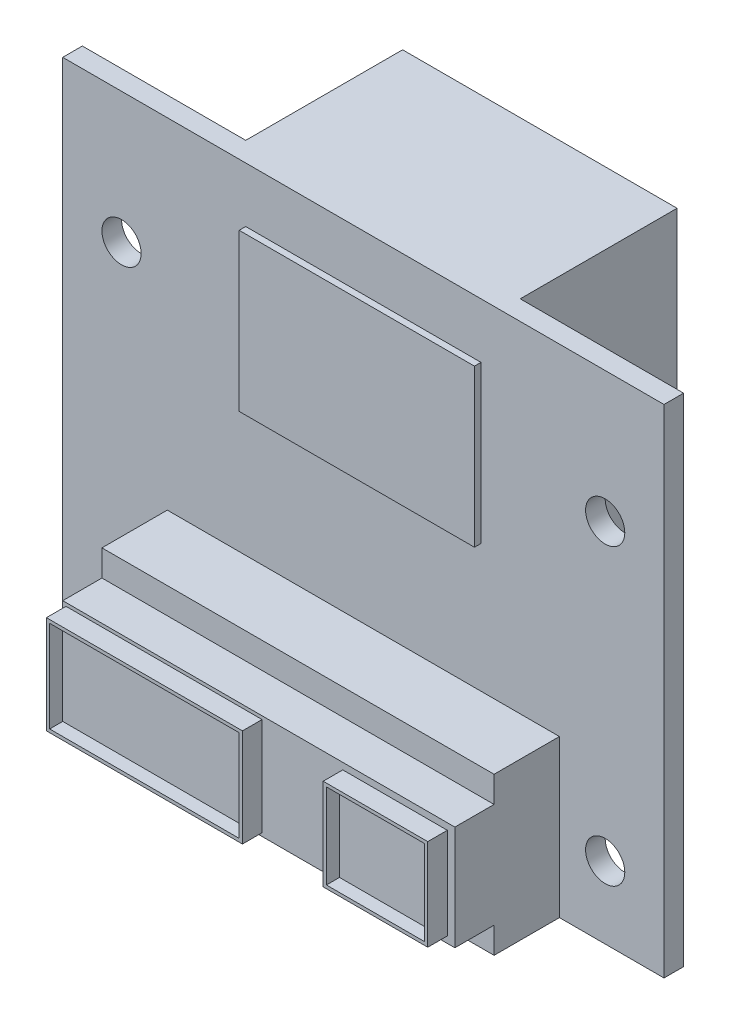
from build123d import *

# Parameters (mm, degrees)
SKETCH2_W           = 46
SKETCH2_H           = 38
SKETCH2_R           = 1.5
BOSS_EXTRUDE1_DEPTH = 1.5
SKETCH3_W           = 30
SKETCH3_H           = 12
BOSS_EXTRUDE2_DEPTH = 6.5
SKETCH4_W           = 30
SKETCH4_H           = 8
BOSS_EXTRUDE3_DEPTH = 9.5
SKETCH5_W           = 15
SKETCH5_H           = 7.5
BOSS_EXTRUDE4_DEPTH = 11
SKETCH6_W           = 14.5
SKETCH6_H           = 7
CUT_EXTRUDE1_DEPTH  = 11
SKETCH9_W           = 8
SKETCH9_H           = 7
BOSS_EXTRUDE5_DEPTH = 11
SKETCH10_W          = 7.5
SKETCH10_H          = 6.5
CUT_EXTRUDE2_DEPTH  = 11
SKETCH12_W          = 21
SKETCH12_H          = 20
BOSS_EXTRUDE6_DEPTH = 12
SKETCH13_W          = 18
SKETCH13_H          = 12
BOSS_EXTRUDE7_DEPTH = 2


with BuildPart() as part:
    # Sketch2 → Boss-Extrude1 (new body)
    with BuildSketch(Plane.XY):
        with Locations((23, 19)):
            Rectangle(SKETCH2_W, SKETCH2_H)
        with Locations((4.5, 28)):
            Circle(SKETCH2_R, mode=Mode.SUBTRACT)
        with Locations((4.5, 5.5)):
            Circle(SKETCH2_R, mode=Mode.SUBTRACT)
        with Locations((41.5, 5.5)):
            Circle(SKETCH2_R, mode=Mode.SUBTRACT)
        with Locations((41.5, 28)):
            Circle(SKETCH2_R, mode=Mode.SUBTRACT)
    extrude(amount=BOSS_EXTRUDE1_DEPTH)

    # Sketch3 → Boss-Extrude2 (add)
    with BuildSketch(Plane.XY):
        with Locations((23, 6)):
            Rectangle(SKETCH3_W, SKETCH3_H)
    extrude(amount=BOSS_EXTRUDE2_DEPTH)

    # Sketch4 → Boss-Extrude3 (add)
    with BuildSketch(Plane.XY):
        with Locations((23, 6)):
            Rectangle(SKETCH4_W, SKETCH4_H)
    extrude(amount=BOSS_EXTRUDE3_DEPTH)

    # Sketch5 → Boss-Extrude4 (add)
    with BuildSketch(Plane.XY):
        with Locations((15.75, 6)):
            Rectangle(SKETCH5_W, SKETCH5_H)
    extrude(amount=BOSS_EXTRUDE4_DEPTH)

    # Sketch6 → Cut-Extrude1 (cut)
    with BuildSketch(Plane.XY.offset(10)):
        with Locations((15.75, 6)):
            Rectangle(SKETCH6_W, SKETCH6_H)
    extrude(amount=CUT_EXTRUDE1_DEPTH, mode=Mode.SUBTRACT)

    # Sketch9 → Boss-Extrude5 (add)
    with BuildSketch(Plane.XY):
        with Locations((33.424570799, 6)):
            Rectangle(SKETCH9_W, SKETCH9_H)
    extrude(amount=BOSS_EXTRUDE5_DEPTH)

    # Sketch10 → Cut-Extrude2 (cut)
    with BuildSketch(Plane.XY.offset(10)):
        with Locations((33.424570799, 6)):
            Rectangle(SKETCH10_W, SKETCH10_H)
    extrude(amount=CUT_EXTRUDE2_DEPTH, mode=Mode.SUBTRACT)

    # Sketch12 → Boss-Extrude6 (add)
    with BuildSketch(Plane.XY):
        with Locations((23, 28)):
            Rectangle(SKETCH12_W, SKETCH12_H)
    extrude(amount=-BOSS_EXTRUDE6_DEPTH)

    # Sketch13 → Boss-Extrude7 (add)
    with BuildSketch(Plane.XY):
        with Locations((23, 27.789125994)):
            Rectangle(SKETCH13_W, SKETCH13_H)
    extrude(amount=BOSS_EXTRUDE7_DEPTH)


solid = part.part
